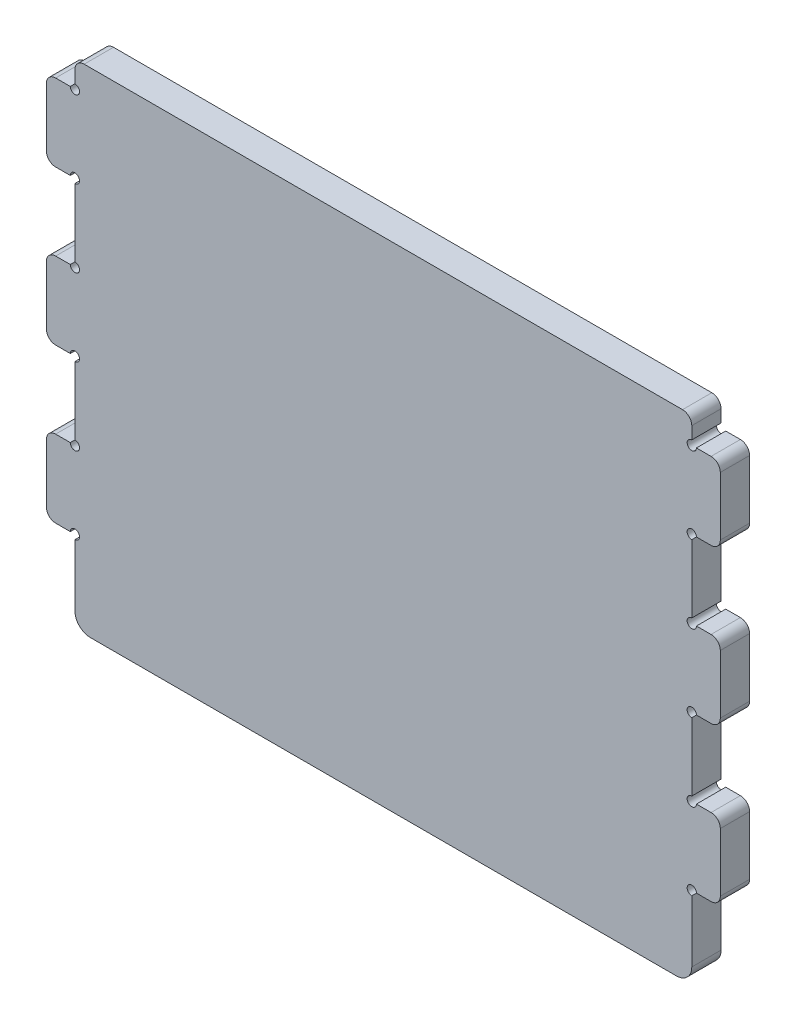
from build123d import *

# Parameters (mm, degrees)
BOSS_EXTRUDE1_DEPTH = 19


with BuildPart() as part:
    # Sketch1 → Boss-Extrude1 (new body)
    with BuildSketch(Plane.XY):
        with BuildLine():
            Line((-203, 38), (-212.5, 38))
            ThreePointArc((-212.5, 38), (-216.742640687, 36.242640687), (-218.5, 32))
            Line((-218.5, 32), (-218.5, -6))
            ThreePointArc((-218.5, -6), (-216.742640687, -10.242640687), (-212.5, -12))
            Line((-212.5, -12), (-203, -12))
            ThreePointArc((-203, -12), (-197.878679656, -9.878679656), (-200, -15))
            Line((-200, -15), (-200, -59))
            ThreePointArc((-200, -59), (-197.878679656, -64.121320344), (-203, -62))
            Line((-203, -62), (-212.5, -62))
            ThreePointArc((-212.5, -62), (-216.742640687, -63.757359313), (-218.5, -68))
            Line((-218.5, -68), (-218.5, -106))
            ThreePointArc((-218.5, -106), (-216.742640687, -110.242640687), (-212.5, -112))
            Line((-212.5, -112), (-203, -112))
            ThreePointArc((-203, -112), (-197.878679656, -109.878679656), (-200, -115))
            Line((-200, -115), (-200, -155))
            ThreePointArc((-200, -155), (-197.071067812, -162.071067812), (-190, -165))
            Line((-190, -165), (190, -165))
            ThreePointArc((190, -165), (197.071067812, -162.071067812), (200, -155))
            Line((200, -155), (200, -115))
            ThreePointArc((200, -115), (197.878679656, -109.878679656), (203, -112))
            Line((203, -112), (212.5, -112))
            ThreePointArc((212.5, -112), (216.742640687, -110.242640687), (218.5, -106))
            Line((218.5, -106), (218.5, -68))
            ThreePointArc((218.5, -68), (216.742640687, -63.757359313), (212.5, -62))
            Line((212.5, -62), (203, -62))
            ThreePointArc((203, -62), (197.878679656, -64.121320344), (200, -59))
            Line((200, -59), (200, -15))
            ThreePointArc((200, -15), (197.878679656, -9.878679656), (203, -12))
            Line((203, -12), (212.5, -12))
            ThreePointArc((212.5, -12), (216.742640687, -10.242640687), (218.5, -6))
            Line((218.5, -6), (218.5, 32))
            ThreePointArc((218.5, 32), (216.742640687, 36.242640687), (212.5, 38))
            Line((212.5, 38), (203, 38))
            ThreePointArc((203, 38), (197.878679656, 35.878679656), (200, 41))
            Line((200, 41), (200, 85))
            ThreePointArc((200, 85), (197.878679656, 90.121320344), (203, 88))
            Line((203, 88), (212.5, 88))
            ThreePointArc((212.5, 88), (216.742640687, 89.757359313), (218.5, 94))
            Line((218.5, 94), (218.5, 132))
            ThreePointArc((218.5, 132), (216.742640687, 136.242640687), (212.5, 138))
            Line((212.5, 138), (203, 138))
            ThreePointArc((203, 138), (197.878679656, 135.878679656), (200, 141))
            Line((200, 141), (200, 149))
            ThreePointArc((200, 149), (198.242640687, 153.242640687), (194, 155))
            Line((194, 155), (-194, 155))
            ThreePointArc((-194, 155), (-198.242640687, 153.242640687), (-200, 149))
            Line((-200, 149), (-200, 141))
            ThreePointArc((-200, 141), (-197.878679656, 135.878679656), (-203, 138))
            Line((-203, 138), (-212.5, 138))
            ThreePointArc((-212.5, 138), (-216.742640687, 136.242640687), (-218.5, 132))
            Line((-218.5, 132), (-218.5, 94))
            ThreePointArc((-218.5, 94), (-216.742640687, 89.757359313), (-212.5, 88))
            Line((-212.5, 88), (-203, 88))
            ThreePointArc((-203, 88), (-197.878679656, 90.121320344), (-200, 85))
            Line((-200, 85), (-200, 41))
            ThreePointArc((-200, 41), (-197.878679656, 35.878679656), (-203, 38))
        make_face()
    extrude(amount=BOSS_EXTRUDE1_DEPTH)


solid = part.part
